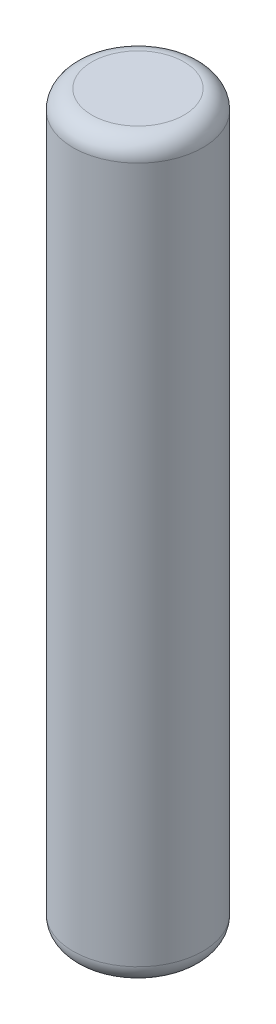
from build123d import *

# Parameters (mm, degrees)
SKETCH1_R           = 3.45
BOSS_EXTRUDE1_DEPTH = 19.5
FILLET1_R           = 1


with BuildPart() as part:
    # Sketch1 → Boss-Extrude1 (new, symmetric)
    with BuildSketch(Plane(origin=(0, 0, 0), x_dir=(1, 0, 0), z_dir=(0, 1, 0))):
        with Locations(Location((0, 0, 0), (0, 0, 270))):
            Circle(SKETCH1_R)
    extrude(amount=BOSS_EXTRUDE1_DEPTH, both=True)

    # Fillet1
    fillet1_edges = [part.edges().sort_by_distance(p)[0] for p in [
        (0, -19.5, -3.45),
        (0, 19.5, -3.45),
    ]]
    fillet(fillet1_edges, radius=FILLET1_R)


solid = part.part
